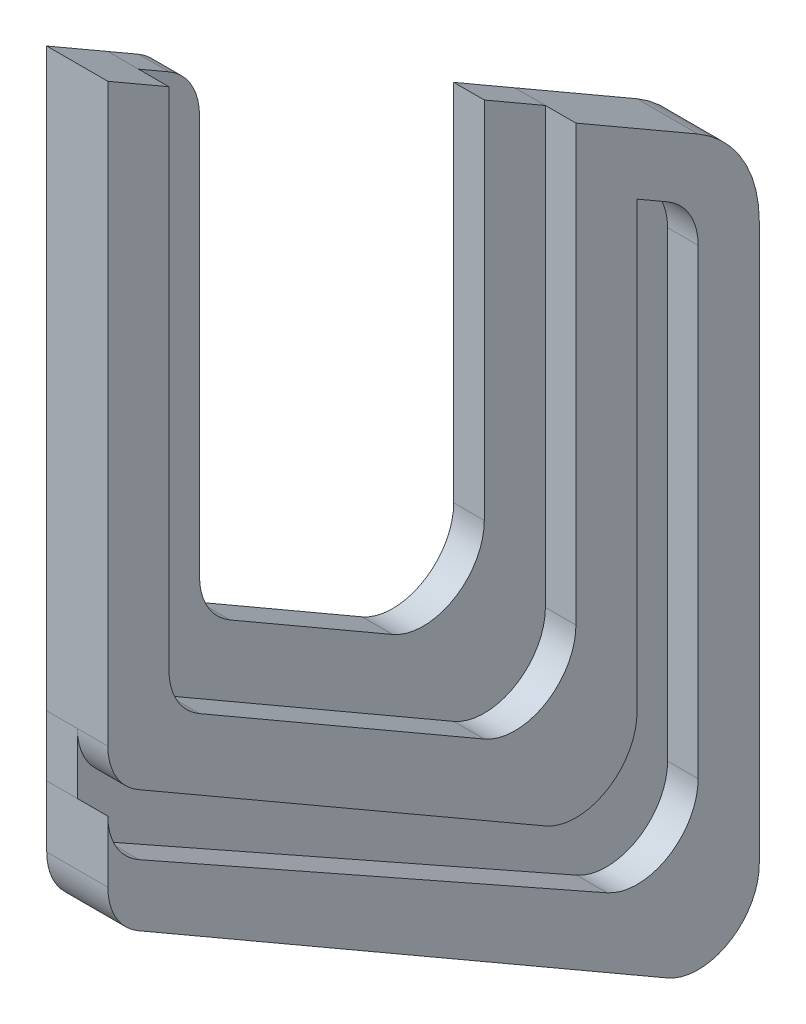
from build123d import *

# Parameters (mm, degrees)
BOSS_EXTRUDE1_DEPTH = 10
BOSS_EXTRUDE2_START = -5
BOSS_EXTRUDE2_DEPTH = 5
BOSS_EXTRUDE3_DEPTH = 5


with BuildPart() as part:
    # Sketch1 → Boss-Extrude1 (new body)
    with BuildSketch(Plane.YZ):
        with BuildLine():
            Line((94.982533692, 86.602540378), (0.756036384, 86.602540378))
            ThreePointArc((0.756036384, 86.602540378), (-4.243963616, 85.262794416), (-7.904217654, 81.602540378))
            Line((-7.904217654, 81.602540378), (-46.35721227, 15))
            ThreePointArc((-46.35721227, 15), (-46.35721227, 5), (-37.696958232, 0))
            Line((-37.696958232, 0), (34.982533692, 0))
            Line((34.982533692, 0), (32.095782346, -5))
            ThreePointArc((32.095782346, -5), (28.435528308, -8.660254038), (23.435528308, -10))
            Line((23.435528308, -10), (-52.162828812, -10))
            ThreePointArc((-52.162828812, -10), (-60.79269002, -5.052276273), (-60.882917416, 4.894900893))
            Line((-60.882917416, 4.894900893), (-17.883142944, 81.497441271))
            ThreePointArc((-17.883142944, 81.497441271), (-14.215330614, 85.232401586), (-9.163054341, 86.602540378))
            Line((-9.163054341, 86.602540378), (-15.017466308, 86.602540378))
            Line((-15.017466308, 86.602540378), (-19.243963616, 86.602540378))
            ThreePointArc((-19.243963616, 86.602540378), (-24.243963616, 85.262794416), (-27.904217654, 81.602540378))
            Line((-27.904217654, 81.602540378), (-77.904217654, -5))
            ThreePointArc((-77.904217654, -5), (-77.904217654, -15), (-69.243963616, -20))
            Line((-69.243963616, -20), (21.888522925, -20))
            ThreePointArc((21.888522925, -20), (31.888522925, -17.320508076), (39.209031, -10))
            Line((39.209031, -10), (50.756036384, 10))
            Line((50.756036384, 10), (-20.376450156, 10))
            ThreePointArc((-20.376450156, 10), (-29.036704194, 15), (-29.036704194, 25))
            Line((-29.036704194, 25), (-2.130714962, 71.602540378))
            ThreePointArc((-2.130714962, 71.602540378), (1.529539076, 75.262794416), (6.529539076, 76.602540378))
            Line((6.529539076, 76.602540378), (83.435528308, 76.602540378))
            Line((83.435528308, 76.602540378), (89.209031, 76.602540378))
            Line((89.209031, 76.602540378), (92.095782346, 81.602540378))
            Line((92.095782346, 81.602540378), (94.982533692, 86.602540378))
        make_face()
    extrude(amount=BOSS_EXTRUDE1_DEPTH)


with BuildPart() as body_2:
    # Sketch2 → Boss-Extrude2 (new body)
    with BuildSketch(Plane.YZ.offset(10).offset(BOSS_EXTRUDE2_START)):
        with BuildLine():
            Line((-9.163054341, 86.602540378), (0.756036384, 86.602540378))
            ThreePointArc((0.756036384, 86.602540378), (-4.243963616, 85.262794416), (-7.904217654, 81.602540378))
            Line((-7.904217654, 81.602540378), (-46.35721227, 15))
            ThreePointArc((-46.35721227, 15), (-46.35721227, 5), (-37.696958232, 0))
            Line((-37.696958232, 0), (34.982533692, 0))
            Line((34.982533692, 0), (32.095782346, -5))
            ThreePointArc((32.095782346, -5), (28.435528308, -8.660254038), (23.435528308, -10))
            Line((23.435528308, -10), (-52.162828812, -10))
            ThreePointArc((-52.162828812, -10), (-60.79269002, -5.052276273), (-60.882917416, 4.894900893))
            Line((-60.882917416, 4.894900893), (-17.883142944, 81.497441271))
            ThreePointArc((-17.883142944, 81.497441271), (-14.215330614, 85.232401586), (-9.163054341, 86.602540378))
        make_face()
    extrude(amount=-BOSS_EXTRUDE2_DEPTH)


with BuildPart() as body_3:
    # Sketch3 → Boss-Extrude3 (new body)
    with BuildSketch(Plane.YZ.offset(5)):
        with BuildLine():
            Line((-11.716196119, 35), (3.64278773, 61.602540378))
            ThreePointArc((3.64278773, 61.602540378), (7.303041768, 65.262794416), (12.303041768, 66.602540378))
            Line((12.303041768, 66.602540378), (77.662025616, 66.602540378))
            ThreePointArc((77.662025616, 66.602540378), (82.662025616, 67.942286341), (86.322279654, 71.602540378))
            Line((86.322279654, 71.602540378), (89.209031, 76.602540378))
            Line((89.209031, 76.602540378), (6.529539076, 76.602540378))
            ThreePointArc((6.529539076, 76.602540378), (1.529539076, 75.262794416), (-2.130714962, 71.602540378))
            Line((-2.130714962, 71.602540378), (-29.036704194, 25))
            ThreePointArc((-29.036704194, 25), (-29.036704194, 15), (-20.376450156, 10))
            Line((-20.376450156, 10), (50.756036384, 10))
            Line((50.756036384, 10), (56.529539076, 20))
            Line((56.529539076, 20), (-3.055942081, 20))
            ThreePointArc((-3.055942081, 20), (-11.716196119, 25), (-11.716196119, 35))
        make_face()
    extrude(amount=-BOSS_EXTRUDE3_DEPTH)


solid = Compound([part.part, body_2.part, body_3.part])
